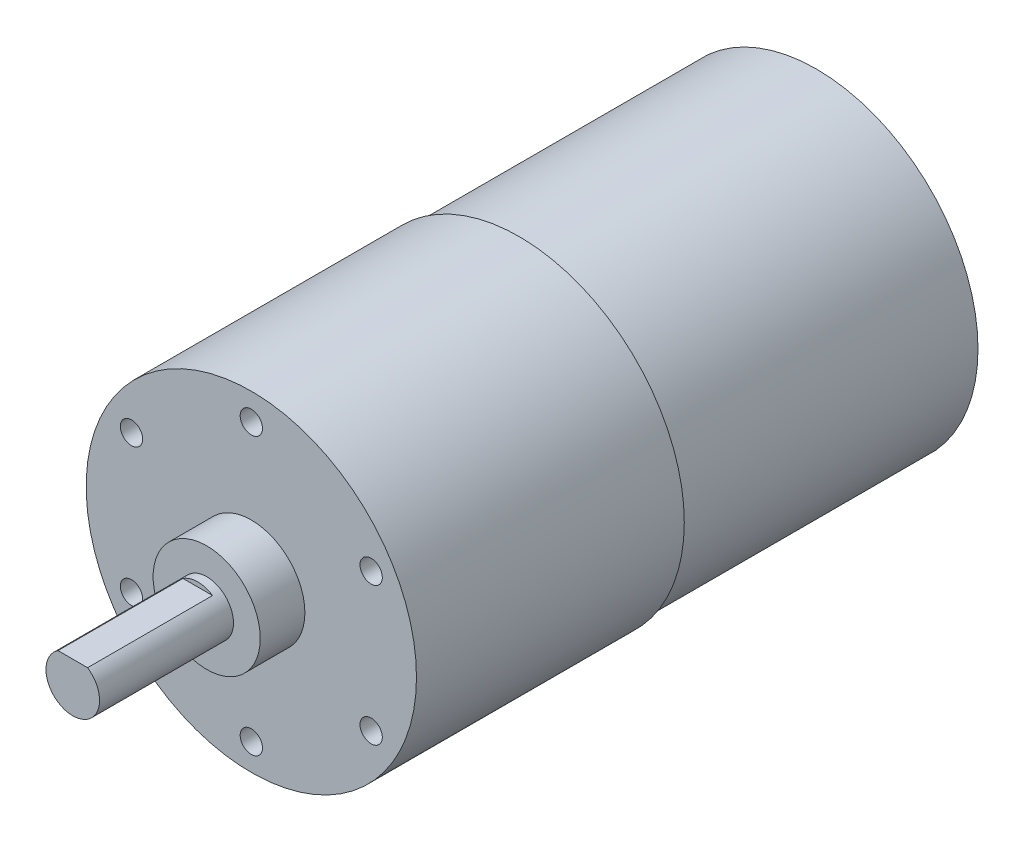
from build123d import *

# Parameters (mm, degrees)
SKETCH1_R                 = 18.5
BOSS_EXTRUDE1_DEPTH       = 30
SKETCH2_R                 = 18.1
BOSS_EXTRUDE2_DEPTH       = 33.3
SKETCH3_R                 = 6
BOSS_EXTRUDE3_DEPTH       = 5
SKETCH4_R                 = 3
BOSS_EXTRUDE4_DEPTH       = 1
BOSS_EXTRUDE5_DEPTH       = 14
M3X0_5_TAPPED_HOLE1_D     = 2.5
M3X0_5_TAPPED_HOLE1_DEPTH = 6
M3X0_5_TAPPED_HOLE1_TIP   = 0.751075774


with BuildPart() as part:
    # Sketch1 → Boss-Extrude1 (new body)
    with BuildSketch(Plane.XY):
        Circle(SKETCH1_R)
    extrude(amount=BOSS_EXTRUDE1_DEPTH)

    # Sketch2 → Boss-Extrude2 (add)
    with BuildSketch(Plane(origin=(0, 0, 0), x_dir=(-1, 0, 0), z_dir=(0, 0, -1))):
        Circle(SKETCH2_R)
    extrude(amount=BOSS_EXTRUDE2_DEPTH)

    # Sketch3 → Boss-Extrude3 (add)
    with BuildSketch(Plane.XY.offset(30)):
        Circle(SKETCH3_R)
    extrude(amount=BOSS_EXTRUDE3_DEPTH)

    # Sketch4 → Boss-Extrude4 (add)
    with BuildSketch(Plane.XY.offset(35)):
        Circle(SKETCH4_R)
    extrude(amount=BOSS_EXTRUDE4_DEPTH)

    # Sketch5 → Boss-Extrude5 (add)
    with BuildSketch(Plane.XY.offset(36)):
        with BuildLine():
            Line((-1.658312395, 2.5), (1.658312395, 2.5))
            ThreePointArc((1.658312395, 2.5), (0, -3), (-1.658312395, 2.5))
        make_face()
    extrude(amount=BOSS_EXTRUDE5_DEPTH)

    # M3x0.5 Tapped Hole1
    with Locations(Plane.XY.offset(30)):
        with Locations((0, 15.5), (13.423393759, 7.75), (13.423393759, -7.75), (0, -15.5), (-13.423393759, -7.75), (-13.423393759, 7.75)):
            Hole(M3X0_5_TAPPED_HOLE1_D / 2, depth=M3X0_5_TAPPED_HOLE1_DEPTH)
            with Locations((0, 0, -(M3X0_5_TAPPED_HOLE1_DEPTH + M3X0_5_TAPPED_HOLE1_TIP / 2))):  # 118° drill point
                Cone(0, M3X0_5_TAPPED_HOLE1_D / 2, M3X0_5_TAPPED_HOLE1_TIP, mode=Mode.SUBTRACT)


solid = part.part
